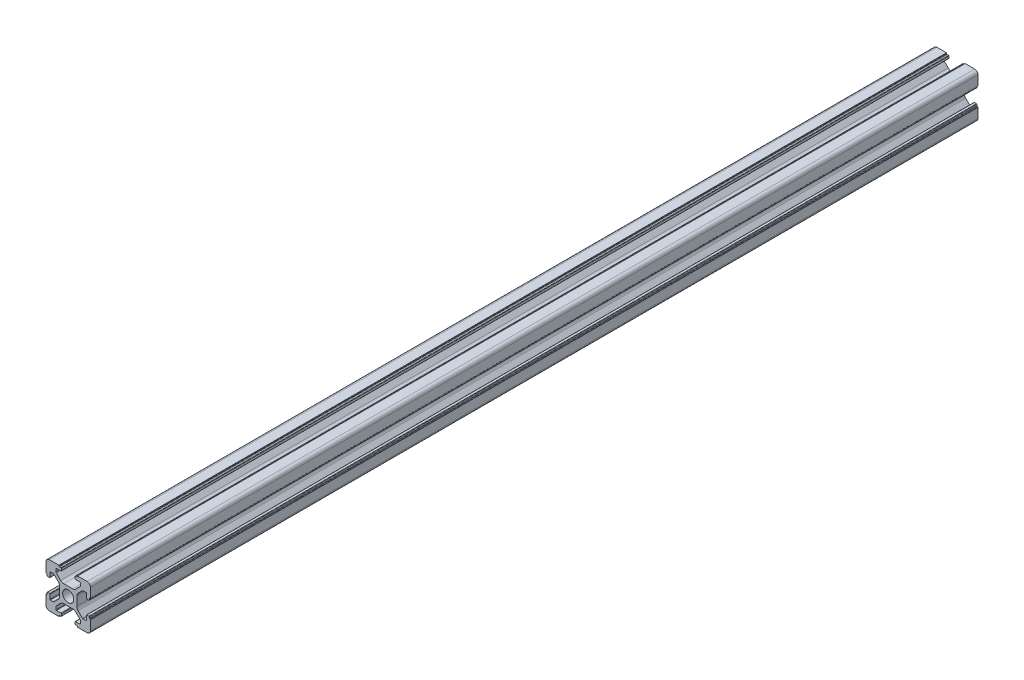
from build123d import *

# Parameters (mm, degrees)
SKETCH1_R           = 2.5
BOSS_EXTRUDE1_DEPTH = 400


with BuildPart() as part:
    # Sketch1 → Boss-Extrude1 (new body)
    with BuildSketch(Plane(origin=(0, 0, 0), x_dir=(1, 0, 0), z_dir=(0, 0, -1))):
        with BuildLine():
            Line((1.5, 0), (5.8, 0))
            ThreePointArc((5.8, 0), (5.870710678, 0.029289322), (5.9, 0.1))
            Line((5.9, 0.1), (5.9, 0.3))
            ThreePointArc((5.9, 0.3), (5.958578644, 0.441421356), (6.1, 0.5))
            Line((6.1, 0.5), (6.7, 0.5))
            ThreePointArc((6.7, 0.5), (6.841421356, 0.558578644), (6.9, 0.7))
            Line((6.9, 0.7), (6.9, 1.6))
            ThreePointArc((6.9, 1.6), (6.841421356, 1.741421356), (6.7, 1.8))
            Line((6.7, 1.8), (4.7, 1.8))
            ThreePointArc((4.7, 1.8), (4.558578644, 1.858578644), (4.5, 2))
            Line((4.5, 2), (4.5, 3.31507576))
            ThreePointArc((4.5, 3.31507576), (4.52283614, 3.429880789), (4.587867966, 3.527207794))
            Line((4.587867966, 3.527207794), (6.574873734, 5.514213562))
            ThreePointArc((6.574873734, 5.514213562), (7.223720432, 5.947759065), (7.989087297, 6.1))
            Line((7.989087297, 6.1), (12.010912703, 6.1))
            ThreePointArc((12.010912703, 6.1), (12.776279568, 5.947759065), (13.425126266, 5.514213562))
            Line((13.425126266, 5.514213562), (15.412132034, 3.527207794))
            ThreePointArc((15.412132034, 3.527207794), (15.47716386, 3.429880789), (15.5, 3.31507576))
            Line((15.5, 3.31507576), (15.5, 2))
            ThreePointArc((15.5, 2), (15.441421356, 1.858578644), (15.3, 1.8))
            Line((15.3, 1.8), (13.3, 1.8))
            ThreePointArc((13.3, 1.8), (13.158578644, 1.741421356), (13.1, 1.6))
            Line((13.1, 1.6), (13.1, 0.7))
            ThreePointArc((13.1, 0.7), (13.158578644, 0.558578644), (13.3, 0.5))
            Line((13.3, 0.5), (13.9, 0.5))
            ThreePointArc((13.9, 0.5), (14.041421356, 0.441421356), (14.1, 0.3))
            Line((14.1, 0.3), (14.1, 0.1))
            ThreePointArc((14.1, 0.1), (14.129289322, 0.029289322), (14.2, 0))
            Line((14.2, 0), (18.5, 0))
            ThreePointArc((18.5, 0), (19.560660172, 0.439339828), (20, 1.5))
            Line((20, 1.5), (20, 5.8))
            ThreePointArc((20, 5.8), (19.970710678, 5.870710678), (19.9, 5.9))
            Line((19.9, 5.9), (19.7, 5.9))
            ThreePointArc((19.7, 5.9), (19.558578644, 5.958578644), (19.5, 6.1))
            Line((19.5, 6.1), (19.5, 6.7))
            ThreePointArc((19.5, 6.7), (19.441421356, 6.841421356), (19.3, 6.9))
            Line((19.3, 6.9), (18.4, 6.9))
            ThreePointArc((18.4, 6.9), (18.258578644, 6.841421356), (18.2, 6.7))
            Line((18.2, 6.7), (18.2, 4.7))
            ThreePointArc((18.2, 4.7), (18.141421356, 4.558578644), (18, 4.5))
            Line((18, 4.5), (16.68492424, 4.5))
            ThreePointArc((16.68492424, 4.5), (16.570119211, 4.52283614), (16.472792206, 4.587867966))
            Line((16.472792206, 4.587867966), (14.485786438, 6.574873734))
            ThreePointArc((14.485786438, 6.574873734), (14.052240935, 7.223720432), (13.9, 7.989087297))
            Line((13.9, 7.989087297), (13.9, 12.010912703))
            ThreePointArc((13.9, 12.010912703), (14.052240935, 12.776279568), (14.485786438, 13.425126266))
            Line((14.485786438, 13.425126266), (16.472792206, 15.412132034))
            ThreePointArc((16.472792206, 15.412132034), (16.570119211, 15.47716386), (16.68492424, 15.5))
            Line((16.68492424, 15.5), (18, 15.5))
            ThreePointArc((18, 15.5), (18.141421356, 15.441421356), (18.2, 15.3))
            Line((18.2, 15.3), (18.2, 13.3))
            ThreePointArc((18.2, 13.3), (18.258578644, 13.158578644), (18.4, 13.1))
            Line((18.4, 13.1), (19.3, 13.1))
            ThreePointArc((19.3, 13.1), (19.441421356, 13.158578644), (19.5, 13.3))
            Line((19.5, 13.3), (19.5, 13.9))
            ThreePointArc((19.5, 13.9), (19.558578644, 14.041421356), (19.7, 14.1))
            Line((19.7, 14.1), (19.9, 14.1))
            ThreePointArc((19.9, 14.1), (19.970710678, 14.129289322), (20, 14.2))
            Line((20, 14.2), (20, 18.5))
            ThreePointArc((20, 18.5), (19.560660172, 19.560660172), (18.5, 20))
            Line((18.5, 20), (14.2, 20))
            ThreePointArc((14.2, 20), (14.129289322, 19.970710678), (14.1, 19.9))
            Line((14.1, 19.9), (14.1, 19.7))
            ThreePointArc((14.1, 19.7), (14.041421356, 19.558578644), (13.9, 19.5))
            Line((13.9, 19.5), (13.3, 19.5))
            ThreePointArc((13.3, 19.5), (13.158578644, 19.441421356), (13.1, 19.3))
            Line((13.1, 19.3), (13.1, 18.4))
            ThreePointArc((13.1, 18.4), (13.158578644, 18.258578644), (13.3, 18.2))
            Line((13.3, 18.2), (15.3, 18.2))
            ThreePointArc((15.3, 18.2), (15.441421356, 18.141421356), (15.5, 18))
            Line((15.5, 18), (15.5, 16.68492424))
            ThreePointArc((15.5, 16.68492424), (15.47716386, 16.570119211), (15.412132034, 16.472792206))
            Line((15.412132034, 16.472792206), (13.425126266, 14.485786438))
            ThreePointArc((13.425126266, 14.485786438), (12.776279568, 14.052240935), (12.010912703, 13.9))
            Line((12.010912703, 13.9), (7.989087297, 13.9))
            ThreePointArc((7.989087297, 13.9), (7.223720432, 14.052240935), (6.574873734, 14.485786438))
            Line((6.574873734, 14.485786438), (4.587867966, 16.472792206))
            ThreePointArc((4.587867966, 16.472792206), (4.52283614, 16.570119211), (4.5, 16.68492424))
            Line((4.5, 16.68492424), (4.5, 18))
            ThreePointArc((4.5, 18), (4.558578644, 18.141421356), (4.7, 18.2))
            Line((4.7, 18.2), (6.7, 18.2))
            ThreePointArc((6.7, 18.2), (6.841421356, 18.258578644), (6.9, 18.4))
            Line((6.9, 18.4), (6.9, 19.3))
            ThreePointArc((6.9, 19.3), (6.841421356, 19.441421356), (6.7, 19.5))
            Line((6.7, 19.5), (6.1, 19.5))
            ThreePointArc((6.1, 19.5), (5.958578644, 19.558578644), (5.9, 19.7))
            Line((5.9, 19.7), (5.9, 19.9))
            ThreePointArc((5.9, 19.9), (5.870710678, 19.970710678), (5.8, 20))
            Line((5.8, 20), (1.5, 20))
            ThreePointArc((1.5, 20), (0.439339828, 19.560660172), (0, 18.5))
            Line((0, 18.5), (0, 14.2))
            ThreePointArc((0, 14.2), (0.029289322, 14.129289322), (0.1, 14.1))
            Line((0.1, 14.1), (0.3, 14.1))
            ThreePointArc((0.3, 14.1), (0.441421356, 14.041421356), (0.5, 13.9))
            Line((0.5, 13.9), (0.5, 13.3))
            ThreePointArc((0.5, 13.3), (0.558578644, 13.158578644), (0.7, 13.1))
            Line((0.7, 13.1), (1.6, 13.1))
            ThreePointArc((1.6, 13.1), (1.741421356, 13.158578644), (1.8, 13.3))
            Line((1.8, 13.3), (1.8, 15.3))
            ThreePointArc((1.8, 15.3), (1.858578644, 15.441421356), (2, 15.5))
            Line((2, 15.5), (3.31507576, 15.5))
            ThreePointArc((3.31507576, 15.5), (3.429880789, 15.47716386), (3.527207794, 15.412132034))
            Line((3.527207794, 15.412132034), (5.514213562, 13.425126266))
            ThreePointArc((5.514213562, 13.425126266), (5.947759065, 12.776279568), (6.1, 12.010912703))
            Line((6.1, 12.010912703), (6.1, 7.989087297))
            ThreePointArc((6.1, 7.989087297), (5.947759065, 7.223720432), (5.514213562, 6.574873734))
            Line((5.514213562, 6.574873734), (3.527207794, 4.587867966))
            ThreePointArc((3.527207794, 4.587867966), (3.429880789, 4.52283614), (3.31507576, 4.5))
            Line((3.31507576, 4.5), (2, 4.5))
            ThreePointArc((2, 4.5), (1.858578644, 4.558578644), (1.8, 4.7))
            Line((1.8, 4.7), (1.8, 6.7))
            ThreePointArc((1.8, 6.7), (1.741421356, 6.841421356), (1.6, 6.9))
            Line((1.6, 6.9), (0.7, 6.9))
            ThreePointArc((0.7, 6.9), (0.558578644, 6.841421356), (0.5, 6.7))
            Line((0.5, 6.7), (0.5, 6.1))
            ThreePointArc((0.5, 6.1), (0.441421356, 5.958578644), (0.3, 5.9))
            Line((0.3, 5.9), (0.1, 5.9))
            ThreePointArc((0.1, 5.9), (0.029289322, 5.870710678), (0, 5.8))
            Line((0, 5.8), (0, 1.5))
            ThreePointArc((0, 1.5), (0.439339828, 0.439339828), (1.5, 0))
        make_face()
        with Locations(Location((10, 10, 0), (0, 0, 180))):
            Circle(SKETCH1_R, mode=Mode.SUBTRACT)
    extrude(amount=BOSS_EXTRUDE1_DEPTH)


solid = part.part
